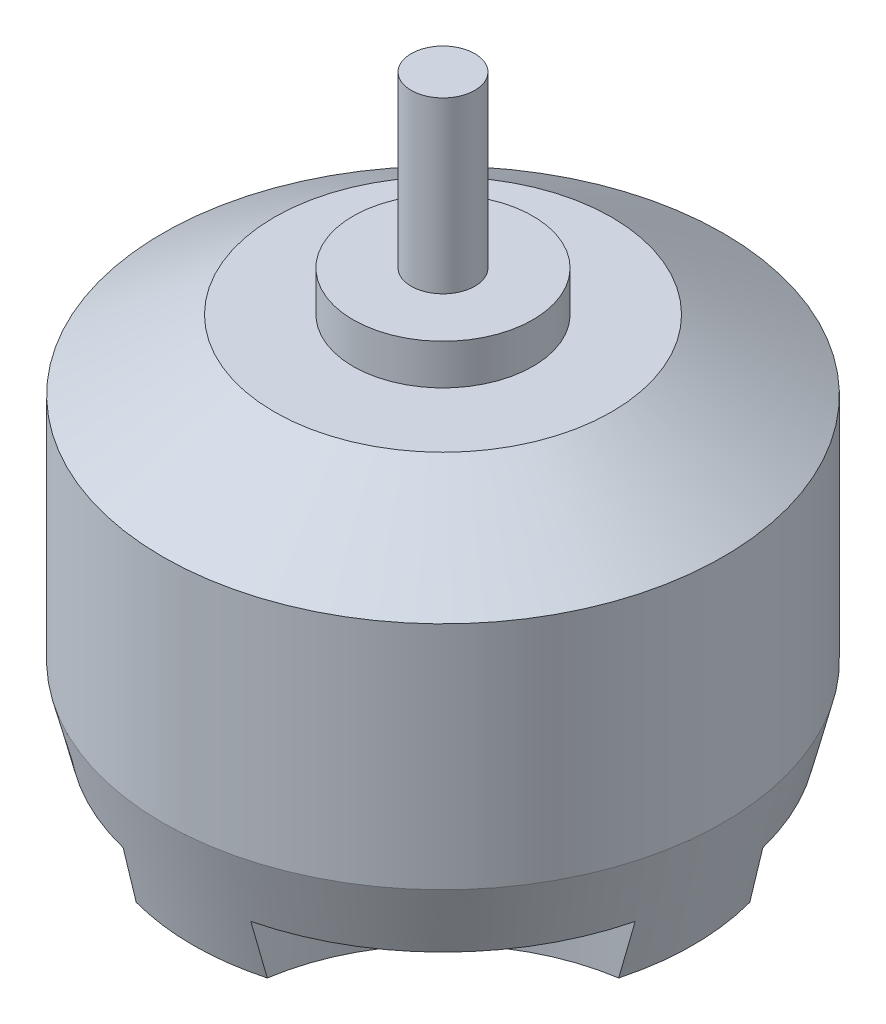
from build123d import *

# Parameters (mm, degrees)
SKETCH1_R      = 13.875
EXTRUDE1_DEPTH = 20.85
SKETCH3_R      = 4.45
EXTRUDE2_DEPTH = 2
EXTRUDE3_DEPTH = 2.75
SKETCH6_R      = 1.575
EXTRUDE4_DEPTH = 8.4
EXTRUDE5_START = 1.4
SKETCH7_R      = 1.575
EXTRUDE5_DEPTH = 1.4
SKETCH8_R      = 1.2
EXTRUDE7_DEPTH = 3


with BuildPart() as part:
    # Sketch1 → Extrude1 (new body)
    with BuildSketch(Plane(origin=(0, 0, 0), x_dir=(1, 0, 0), z_dir=(0, 1, 0))):
        with Locations(Location((0, 0, 0), (0, 0, 270))):
            Circle(SKETCH1_R)
    extrude(amount=EXTRUDE1_DEPTH)

    # Sketch2 → Cut-Revolve1 (revolve, cut)
    with BuildSketch(Plane.XY, mode=Mode.PRIVATE) as cut_revolve1_sk:
        Polygon((8.35, 20.85), (13.875, 17.4), (13.875, 20.85), align=None)
    revolve(cut_revolve1_sk.sketch.rotate(Axis((0, 20.85, 0), (0, -1, 0)), 90), axis=Axis((0, 20.85, 0), (0, -1, 0)), mode=Mode.SUBTRACT)

    # Sketch3 → Extrude2 (add)
    with BuildSketch(Plane(origin=(0, 20.85, 0), x_dir=(1, 0, 0), z_dir=(0, 1, 0))):
        with Locations(Location((0, 0, 0), (0, 0, 270))):
            Circle(SKETCH3_R)
    extrude(amount=EXTRUDE2_DEPTH)

    # Sketch4 → Extrude3 (cut)
    with BuildSketch(Plane.XZ):
        with BuildLine():
            ThreePointArc((-13.518505835, 3.125), (-6.169187379, 6.169187379), (-3.125, 13.518505835))
            ThreePointArc((-3.125, 13.518505835), (-9.811106589, 9.811106589), (-13.518505835, 3.125))
        make_face()
        with BuildLine():
            ThreePointArc((3.125, 13.518505835), (6.169187379, 6.169187379), (13.518505835, 3.125))
            ThreePointArc((13.518505835, 3.125), (9.811106589, 9.811106589), (3.125, 13.518505835))
        make_face()
        with BuildLine():
            ThreePointArc((13.518505835, -3.125), (6.169187379, -6.169187379), (3.125, -13.518505835))
            ThreePointArc((3.125, -13.518505835), (9.811106589, -9.811106589), (13.518505835, -3.125))
        make_face()
        with BuildLine():
            ThreePointArc((-3.125, -13.518505835), (-6.169187379, -6.169187379), (-13.518505835, -3.125))
            ThreePointArc((-13.518505835, -3.125), (-9.811106589, -9.811106589), (-3.125, -13.518505835))
        make_face()
    extrude(amount=-EXTRUDE3_DEPTH, mode=Mode.SUBTRACT)

    # Sketch5 → Cut-Revolve2 (revolve, cut)
    with BuildSketch(Plane(origin=(0, 0, 0), x_dir=(0, 0, -1), z_dir=(1, 0, 0))):
        Polygon((-13.875, 0), (-12.375, 0), (-13.875, 6), align=None)
    revolve(axis=Axis((0, 20.85, 0), (0, -1, 0)), mode=Mode.SUBTRACT)

    # Sketch6 → Extrude4 (add)
    with BuildSketch(Plane(origin=(0, 22.85, 0), x_dir=(-1, 0, 0), z_dir=(0, 1, 0))):
        with Locations(Location((0, 0, 0), (0, 0, 90))):
            Circle(SKETCH6_R)
    extrude(amount=EXTRUDE4_DEPTH)

    # Sketch7 → Extrude5 (add)
    with BuildSketch(Plane.XZ.offset(EXTRUDE5_START)):
        with Locations(Location((0, 0, 0), (0, 0, 90))):
            Circle(SKETCH7_R)
    extrude(amount=-EXTRUDE5_DEPTH)

    # Sketch8 → Extrude7 (cut)
    with BuildSketch(Plane.XZ):
        with Locations(Location((-7.95, 0, 0), (0, 0, 270))):
            Circle(SKETCH8_R)
        with Locations(Location((7.95, 0, 0), (0, 0, 270))):
            Circle(SKETCH8_R)
        with Locations(Location((0, 9.45, 0), (0, 0, 270))):
            Circle(SKETCH8_R)
        with Locations(Location((0, -9.45, 0), (0, 0, 270))):
            Circle(SKETCH8_R)
    extrude(amount=-EXTRUDE7_DEPTH, mode=Mode.SUBTRACT)


solid = part.part
